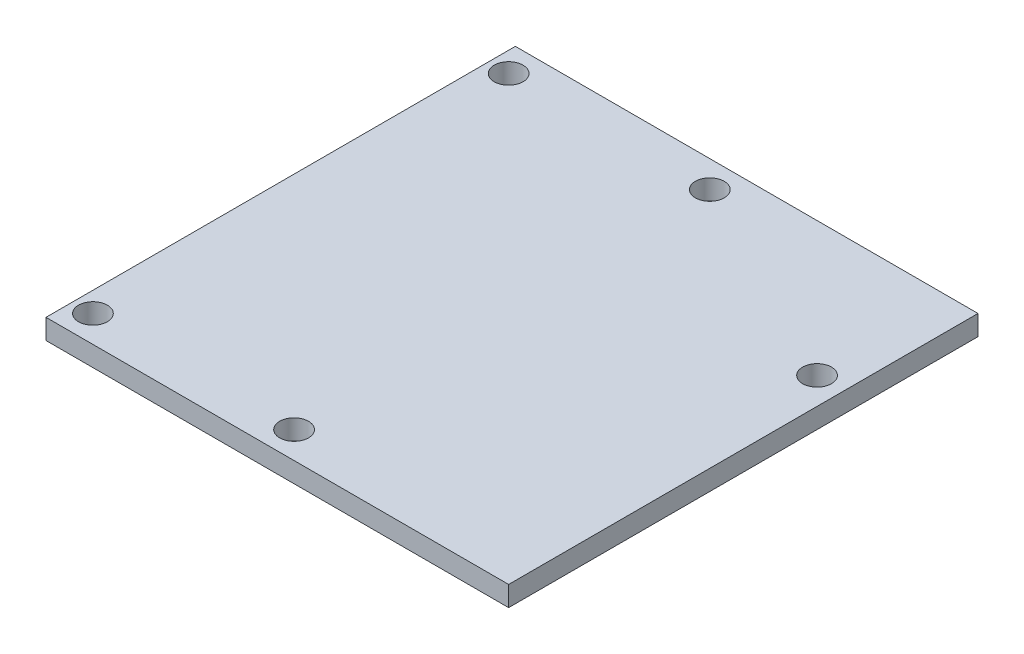
from build123d import *

# Parameters (mm, degrees)
SKETCH1_R           = 2.15
BOSS_EXTRUDE1_DEPTH = 3


with BuildPart() as part:
    # Sketch1 → Boss-Extrude1 (new body)
    with BuildSketch(Plane(origin=(0, 0, 0), x_dir=(1, 0, 0), z_dir=(0, 1, 0))):
        Polygon((18, 35), (51, 35), (51, -35), (18, -35), (-18, -35), (-18, 35), align=None)
        with Locations(Location((15, 31, 0), (0, 0, 270))):
            Circle(SKETCH1_R, mode=Mode.SUBTRACT)
        with Locations(Location((-15, 31, 0), (0, 0, 270))):
            Circle(SKETCH1_R, mode=Mode.SUBTRACT)
        with Locations(Location((-15, -31, 0), (0, 0, 270))):
            Circle(SKETCH1_R, mode=Mode.SUBTRACT)
        with Locations(Location((15, -31, 0), (0, 0, 270))):
            Circle(SKETCH1_R, mode=Mode.SUBTRACT)
        with Locations(Location((47, 15, 0), (0, 0, 270))):
            Circle(SKETCH1_R, mode=Mode.SUBTRACT)
    extrude(amount=BOSS_EXTRUDE1_DEPTH)


solid = part.part
